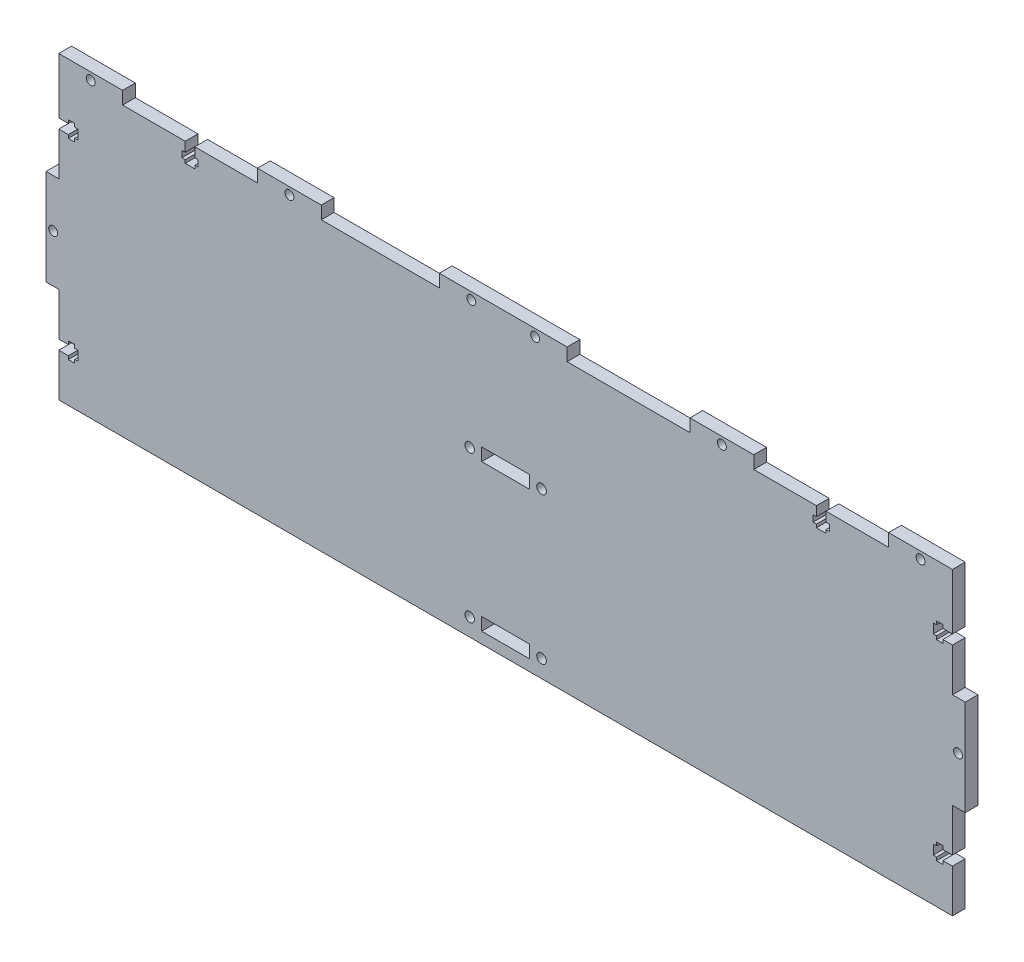
from build123d import *

# Parameters (mm, degrees)
SKETCH_1_W          = 280
SKETCH_1_H          = 90
SKETCH_1_R          = 1.5
SKETCH_1_W_2        = 15
SKETCH_1_H_2        = 4
EXTRUDE_1_DEPTH     = 4
SKETCH_2_W          = 4
SKETCH_2_H          = 30
SKETCH_2_R          = 1.4
SKETCH_2_W_2        = 20
SKETCH_2_H_2        = 4
SKETCH_2_W_3        = 40
EXTRUDE_7_DEPTH     = 4
CUT_EXTRUDE_1_DEPTH = 153.161098839


with BuildPart() as part:
    # Эскиз1 → Бобышка-Вытянуть1 (new body)
    with BuildSketch(Plane.XY):
        Rectangle(SKETCH_1_W, SKETCH_1_H)
        with Locations((11.25, 6.5)):
            Circle(SKETCH_1_R, mode=Mode.SUBTRACT)
        with Locations((-11.25, 6.5)):
            Circle(SKETCH_1_R, mode=Mode.SUBTRACT)
        with Locations((-11.25, -39.5)):
            Circle(SKETCH_1_R, mode=Mode.SUBTRACT)
        with Locations((11.25, -39.5)):
            Circle(SKETCH_1_R, mode=Mode.SUBTRACT)
        with Locations((0, -39.5)):
            Rectangle(SKETCH_1_W_2, SKETCH_1_H_2, mode=Mode.SUBTRACT)
        with Locations((0, 6.5)):
            Rectangle(SKETCH_1_W_2, SKETCH_1_H_2, mode=Mode.SUBTRACT)
    extrude(amount=EXTRUDE_1_DEPTH)

    # Эскиз2 → Бобышка-Вытянуть7 (add, through all)
    # profile 1 of 7: a face of its own
    with BuildSketch(Plane.XY):
        with Locations((-142, 0)):
            Rectangle(SKETCH_2_W, SKETCH_2_H)
        with Locations((-141.75, 0)):
            Circle(SKETCH_2_R, mode=Mode.SUBTRACT)
    # profile 2 of 7: a face of its own
    with BuildSketch(Plane.XY):
        with Locations((-130, 47)):
            Rectangle(SKETCH_2_W_2, SKETCH_2_H_2)
        with Locations((-130, 46.75)):
            Circle(SKETCH_2_R, mode=Mode.SUBTRACT)
    # profile 3 of 7: a face of its own
    with BuildSketch(Plane.XY):
        with Locations((-0.75, 47)):
            Rectangle(SKETCH_2_W_3, SKETCH_2_H_2)
        with Locations((9.25, 46.75)):
            Circle(SKETCH_2_R, mode=Mode.SUBTRACT)
        with Locations((-10.75, 46.75)):
            Circle(SKETCH_2_R, mode=Mode.SUBTRACT)
    # profile 4 of 7: a face of its own
    with BuildSketch(Plane.XY):
        with Locations((130, 47)):
            Rectangle(SKETCH_2_W_2, SKETCH_2_H_2)
        with Locations((130, 46.75)):
            Circle(SKETCH_2_R, mode=Mode.SUBTRACT)
    # profile 5 of 7: a face of its own
    with BuildSketch(Plane.XY):
        with Locations((142, 0)):
            Rectangle(SKETCH_2_W, SKETCH_2_H)
        with Locations((141.75, 0)):
            Circle(SKETCH_2_R, mode=Mode.SUBTRACT)
    # profile 6 of 7: a face of its own
    with BuildSketch(Plane.XY):
        with Locations((-67.75, 47)):
            Rectangle(SKETCH_2_W_2, SKETCH_2_H_2)
        with Locations((-67.75, 46.75)):
            Circle(SKETCH_2_R, mode=Mode.SUBTRACT)
    # profile 7 of 7: a face of its own
    with BuildSketch(Plane.XY):
        with Locations((67.75, 47)):
            Rectangle(SKETCH_2_W_2, SKETCH_2_H_2)
        with Locations((67.75, 46.75)):
            Circle(SKETCH_2_R, mode=Mode.SUBTRACT)
    extrude(amount=EXTRUDE_7_DEPTH)

    # Эскиз3 → Вырез-Вытянуть1 (cut, through all)
    with BuildSketch(Plane.XY.offset(4)):
        Polygon((97.375, 42), (96.325, 42), (96.325, 40), (97.375, 40), (97.375, 39), (100.375, 39), (100.375, 40), (101.425, 40), (101.425, 42), (100.375, 42), (100.375, 45), (97.375, 45), align=None)
        Polygon((-97.375, 45), (-100.375, 45), (-100.375, 42), (-101.425, 42), (-101.425, 40), (-100.375, 40), (-100.375, 39), (-97.375, 39), (-97.375, 40), (-96.325, 40), (-96.325, 42), (-97.375, 42), align=None)
        Polygon((-137, 31.5), (-140, 31.5), (-140, 28.5), (-137, 28.5), (-137, 27.45), (-135, 27.45), (-135, 28.5), (-134, 28.5), (-134, 31.5), (-135, 31.5), (-135, 32.55), (-137, 32.55), align=None)
        Polygon((-137, -32.55), (-135, -32.55), (-135, -31.5), (-134, -31.5), (-134, -28.5), (-135, -28.5), (-135, -27.45), (-137, -27.45), (-137, -28.5), (-140, -28.5), (-140, -31.5), (-137, -31.5), align=None)
        Polygon((137, -31.5), (140, -31.5), (140, -28.5), (137, -28.5), (137, -27.45), (135, -27.45), (135, -28.5), (134, -28.5), (134, -31.5), (135, -31.5), (135, -32.55), (137, -32.55), align=None)
        Polygon((137, 32.55), (135, 32.55), (135, 31.5), (134, 31.5), (134, 28.5), (135, 28.5), (135, 27.45), (137, 27.45), (137, 28.5), (140, 28.5), (140, 31.5), (137, 31.5), align=None)
    extrude(amount=-CUT_EXTRUDE_1_DEPTH, mode=Mode.SUBTRACT)


solid = part.part
